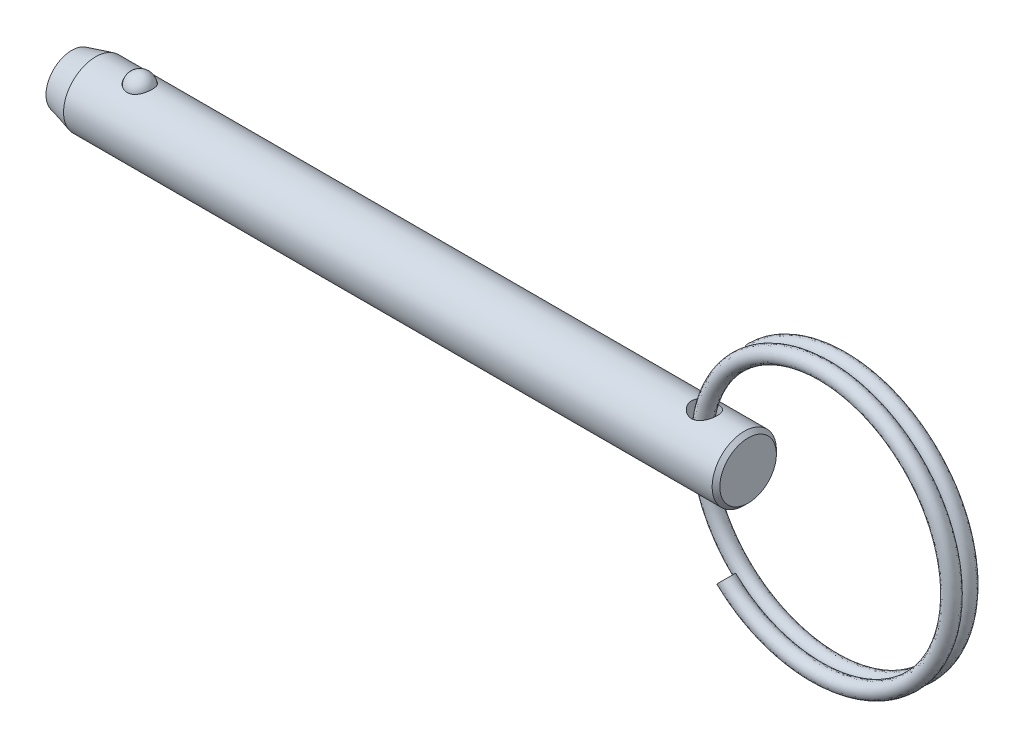
from build123d import *

# Parameters (mm, degrees)
SKETCH4_W          = 1.27
SKETCH4_H          = 6.35
SWEEP1_PITCH       = 1.5494
SWEEP1_HEIGHT      = 1.355725
SWEEP1_RADIUS      = 13.462
SKETCH6_R          = 0.762
SWEEP2_PITCH       = 1.5494
SWEEP2_HEIGHT      = 1.355725
SWEEP2_RADIUS      = 13.462
SWEEP2_START_ANGLE = -180
SKETCH6_2_R        = 0.762


with BuildPart() as part:
    # Sketch1 → Revolve1 (revolve)
    with BuildSketch(Plane.XY, mode=Mode.PRIVATE) as revolve1_sk:
        Polygon((33.4264, 2.794), (33.0454, 3.175), (-31.056547737, 3.175), (-33.4264, 2.54), (-33.4264, 0), (33.4264, 0), align=None)
    revolve(revolve1_sk.sketch.rotate(Axis((33.4264, 0, 0), (1, 0, 0)), 90), axis=Axis((33.4264, 0, 0), (1, 0, 0)))

    # Sketch2 → Cut-Revolve1 (revolve, cut)
    with BuildSketch(Plane.XY):
        with BuildLine():
            Line((-25.434582051, 2.8575), (-27.949182051, 2.8575))
            ThreePointArc((-27.949182051, 2.8575), (-26.691882051, 4.1148), (-25.434582051, 2.8575))
        make_face()
    revolve(axis=Axis((-25.434582051, 2.8575, 0), (1, 0, 0)), mode=Mode.SUBTRACT)

    # Sketch4 → Cut-Revolve2 (revolve, cut)
    with BuildSketch(Plane.XY, mode=Mode.PRIVATE) as cut_revolve2_sk:
        with Locations((29.7434, 0)):
            Rectangle(SKETCH4_W, SKETCH4_H)
    revolve(cut_revolve2_sk.sketch.rotate(Axis((29.1084, -3.175, 0), (0, 1, 0)), 90), axis=Axis((29.1084, -3.175, 0), (0, 1, 0)), mode=Mode.SUBTRACT)


with BuildPart() as body_2:
    # Sketch3 → Revolve2 (revolve)
    with BuildSketch(Plane.XY):
        with BuildLine():
            Line((-25.459982051, 2.8575), (-27.923782051, 2.8575))
            ThreePointArc((-27.923782051, 2.8575), (-26.691882051, 4.0894), (-25.459982051, 2.8575))
        make_face()
    revolve(axis=Axis((-25.459982051, 2.8575, 0), (1, 0, 0)))


with BuildPart() as body_3:
    # Sweep1: sweep along a helix
    with BuildLine() as sweep1_path:
        Helix(SWEEP1_PITCH, SWEEP1_HEIGHT, SWEEP1_RADIUS, center=(41.593425091, 0, 0), direction=(0, 0, -1), lefthand=True)
    # Sketch6 → Sweep1 (sweep)
    with BuildSketch(Plane(origin=(114.003847968, 0, 0), x_dir=(0, 0, -1), z_dir=(0, 1, 0))):
        with Locations((0, 85.110422877)):
            Circle(SKETCH6_R)
    sweep(path=sweep1_path.line, is_frenet=True)

    # Sweep2: sweep along a helix
    with BuildLine() as sweep2_path:
        add(Helix(SWEEP2_PITCH, SWEEP2_HEIGHT, SWEEP2_RADIUS, center=(41.593425091, 0, 0), direction=(0, 0, 1), lefthand=True, mode=Mode.PRIVATE).rotate(Axis((41.593425091, 0, 0), (0, 0, 1)), SWEEP2_START_ANGLE))
    # Sketch6<2> → Sweep2 (sweep)
    with BuildSketch(Plane(origin=(114.003847968, 0, 0), x_dir=(0, 0, -1), z_dir=(0, 1, 0))):
        with Locations((0, 85.110422877)):
            Circle(SKETCH6_2_R)
    sweep(path=sweep2_path.line, is_frenet=True)


solid = Compound([part.part, body_2.part, body_3.part])
